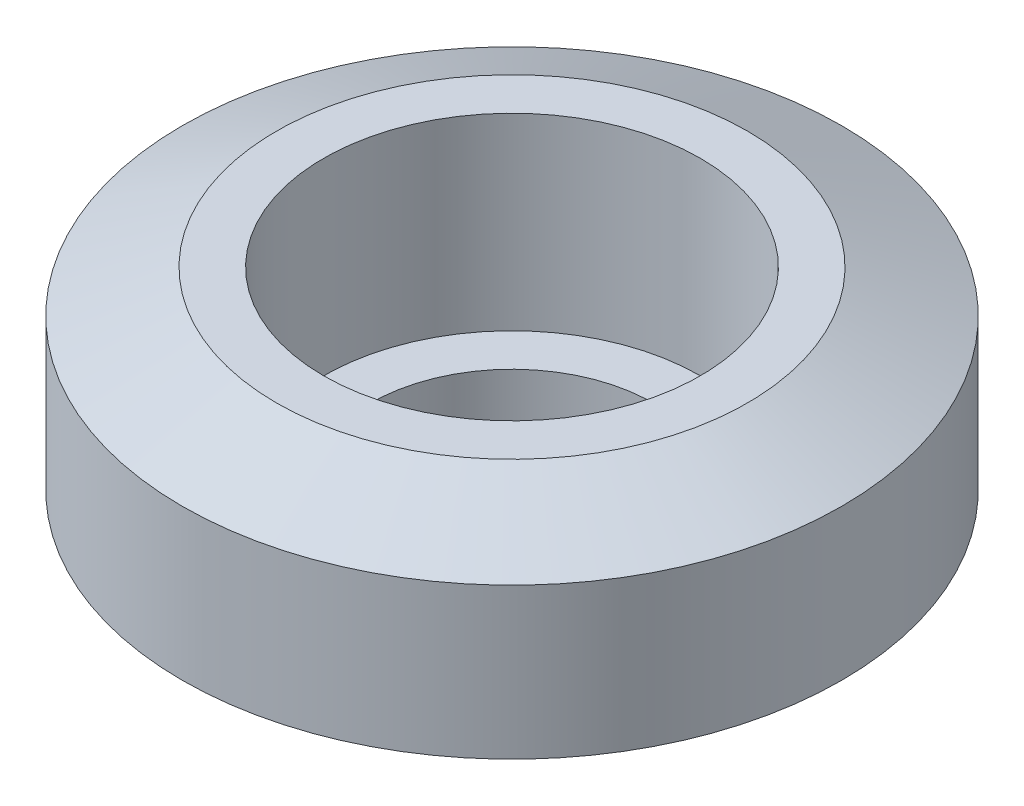
from build123d import *

# Parameters (mm, degrees)
CUT_EXTRUDE_START        = 5
SKETCH_2_R               = 8
CUT_EXTRUDE_1_DEPTH      = 8
CUT_EXTRUDE_2_DEPTH      = 21.420577857
CUT_EXTRUDE_2_DEPTH_BACK = 21.420577857
SKETCH_3_R               = 6


with BuildPart() as part:
    # 草图1 → 旋转1 (revolve)
    with BuildSketch(Plane.XY, mode=Mode.PRIVATE) as revolve_1_sk:
        Polygon((0, 5), (10, 5), (14, 3.2), (14, -3.2), (10, -5), (0, -5), align=None)
    revolve(revolve_1_sk.sketch.rotate(Axis((0, -5, 0), (0, 1, 0)), 90), axis=Axis((0, -5, 0), (0, 1, 0)))

    # 草图2 → 切除-拉伸1 (cut)
    with BuildSketch(Plane(origin=(0, 0, 0), x_dir=(1, 0, 0), z_dir=(0, 1, 0)).offset(CUT_EXTRUDE_START)):
        with Locations(Location((0, 0, 0), (0, 0, 270))):
            Circle(SKETCH_2_R)
    extrude(amount=-CUT_EXTRUDE_1_DEPTH, mode=Mode.SUBTRACT)

    # 草图3 → 切除-拉伸2 (cut, two sides: drawn at the far end of the back side and taken through both)
    with BuildSketch(Plane(origin=(0, 0, 0), x_dir=(1, 0, 0), z_dir=(0, 1, 0)).offset(-CUT_EXTRUDE_2_DEPTH_BACK)):
        with Locations(Location((0, 0, 0), (0, 0, 270))):
            Circle(SKETCH_3_R)
    extrude(amount=CUT_EXTRUDE_2_DEPTH + CUT_EXTRUDE_2_DEPTH_BACK, mode=Mode.SUBTRACT)


solid = part.part
